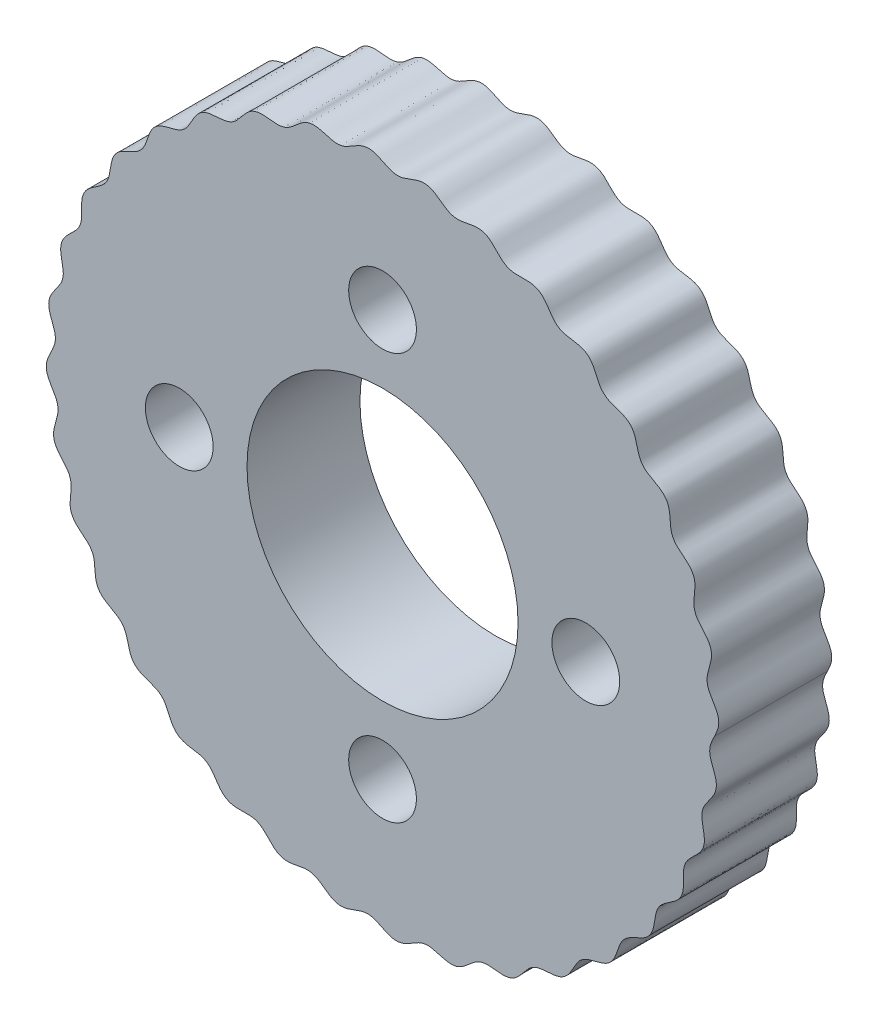
from build123d import *

# Parameters (mm, degrees)
EXTRUDE_1_DEPTH          = 5
EXTRUDE_1_DEPTH_BACK     = 5
SKETCH_1_R               = 12
CUT_EXTRUDE_1_DEPTH      = 10
CUT_EXTRUDE_1_DEPTH_BACK = 10
SKETCH_2_R               = 3


with BuildPart() as part:
    # 草图1 → 凸台-拉伸1 (new, two sides: drawn at the far end of the back side and taken through both)
    with BuildSketch(Plane.XY.offset(-EXTRUDE_1_DEPTH_BACK)):
        with BuildLine():
            add(Edge.make_bspline(
                [(29.4, 1e-09), (29.415799706, 0.032257734), (29.447386284, 0.097157314), (29.504130438, 0.216230806), (29.581276839, 0.388828284), (29.662689077, 0.594615378), (29.736146629, 0.837079135), (29.79281217, 1.177167834), (29.761871702, 1.538482566), (29.661202541, 1.860720262), (29.52960586, 2.143020955), (29.409277433, 2.361282144), (29.281073391, 2.574821404), (29.151314048, 2.787385411), (29.013592374, 3.024352373), (28.8805477, 3.292157346), (28.741661993, 3.681188492), (28.710495892, 4.162346864), (28.820069922, 4.664609592), (28.980612617, 5.187406533), (29.110175028, 5.669040025), (29.161189795, 6.163399707), (29.0681081, 6.650335535), (28.837811598, 7.079047146), (28.541678681, 7.452296187), (28.237076566, 7.788583164), (27.9601478, 8.11960299), (27.740861568, 8.467316311), (27.606987002, 8.833889663), (27.557730755, 9.250478557), (27.583199093, 9.696860688), (27.643664923, 10.169034533), (27.684646208, 10.673210025), (27.639604187, 11.180509219), (27.440858365, 11.651813851), (27.114013611, 12.036813653), (26.734001884, 12.35912965), (26.369533116, 12.641080643), (26.052288593, 12.922691573), (25.80581665, 13.222443157), (25.641395403, 13.53278618), (25.532750281, 13.905442772), (25.481426451, 14.326662638), (25.459161193, 14.786888051), (25.41543983, 15.283233724), (25.294689422, 15.765521226), (25.04045396, 16.191086942), (24.67755534, 16.515280656), (24.271534014, 16.764670299), (23.870340043, 16.976537965), (23.496867346, 17.192857717), (23.17189497, 17.444611691), (22.920711169, 17.743284645), (22.731947862, 18.117906679), (22.603205968, 18.546077397), (22.498533854, 19.010457371), (22.364604651, 19.498243158), (22.148772886, 19.959543512), (21.800816975, 20.334449734), (21.362005845, 20.584443838), (20.894672958, 20.757350056), (20.455751492, 20.897641712), (20.061322511, 21.053765383), (19.727193581, 21.251141376), (19.466544576, 21.486533041), (19.236995499, 21.799556873), (19.044701193, 22.177820288), (18.866372334, 22.602675546), (18.655527473, 23.054134325), (18.377107166, 23.46603726), (17.99265193, 23.778984574), (17.540757995, 23.959508377), (17.073926469, 24.054990512), (16.624464446, 24.116864576), (16.199529196, 24.192403464), (15.808050122, 24.317827717), (15.469862391, 24.512578568), (15.164354624, 24.800047276), (14.896933805, 25.158363819), (14.639746887, 25.558938283), (14.347062038, 25.971500502), (13.986472508, 26.331162229), (13.531275426, 26.564450909), (13.033424826, 26.649286278), (12.535138151, 26.651927715), (12.074704316, 26.633638766), (11.650664873, 26.645444371), (11.269179817, 26.716638311), (10.94374118, 26.848686911), (10.62097515, 27.064322688), (10.310903903, 27.354005502), (9.998020533, 27.692246791), (9.645483177, 28.044366084), (9.242974568, 28.336202879), (8.774670535, 28.498785726), (8.288286362, 28.513865783), (7.816951409, 28.443923855), (7.373433086, 28.348341391), (6.948288745, 28.273988312), (6.537521127, 28.257954828), (6.153119899, 28.325293749), (5.767716415, 28.490936162), (5.393871569, 28.736180267), (5.015190385, 29.024634028), (4.599052003, 29.312211587), (4.137197127, 29.526854175), (3.62966236, 29.590387255), (3.13282042, 29.499831492), (2.663680684, 29.33188955), (2.237269597, 29.157225913), (1.834765106, 29.023289523), (1.451936653, 28.959714368), (1.100961084, 28.972492897), (0.723908452, 29.064731756), (0.333459425, 29.230893958), (-0.076240091, 29.441724363), (-0.527948754, 29.652033425), (-1.005997157, 29.7886042), (-1.501665656, 29.781212777), (-1.963874878, 29.629030058), (-2.382863466, 29.402100401), (-2.766942928, 29.160589478), (-3.141018209, 28.945313536), (-3.521528891, 28.789754566), (-3.905780566, 28.721562201), (-4.324591768, 28.745394304), (-4.759775031, 28.847996678), (-5.214265129, 28.989517152), (-5.703682517, 29.117458396), (-6.211069435, 29.161141245), (-6.709767276, 29.047335675), (-7.145602653, 28.792173717), (-7.529150625, 28.474174684), (-7.869848705, 28.163705506), (-8.202681394, 27.900972769), (-8.616263479, 27.665838441), (-9.084593851, 27.551495613), (-9.598325378, 27.572253944), (-10.141013268, 27.639534156), (-10.637851477, 27.683514959), (-11.133546711, 27.647898492), (-11.596928717, 27.471682063), (-11.979132218, 27.170435226), (-12.295290702, 26.813989846), (-12.573573328, 26.455618062), (-12.851476995, 26.125416346), (-13.155828653, 25.849081358), (-13.493586097, 25.653586072), (-13.895292676, 25.53273811), (-14.339315875, 25.480306162), (-14.814816068, 25.457861206), (-15.318448355, 25.410670762), (-15.810219055, 25.278221438), (-16.239851669, 25.000653829), (-16.562246457, 24.611920061), (-16.813677411, 24.181711985), (-17.028055594, 23.773820037), (-17.25029929, 23.412493948), (-17.502697568, 23.117715151), (-17.779774336, 22.901901333), (-18.127903404, 22.730195634), (-18.533811717, 22.606507471), (-18.983178926, 22.504663158), (-19.464391897, 22.375416515), (-19.918384221, 22.172752207), (-20.293337205, 21.84848048), (-20.549588846, 21.434799393), (-20.724685153, 20.991640517), (-20.863666862, 20.559750897), (-21.011848444, 20.154389001), (-21.203345159, 19.790636366), (-21.453865812, 19.491405768), (-21.790012787, 19.240455566), (-22.189334042, 19.039323135), (-22.628461263, 18.855593505), (-23.08561578, 18.63901075), (-23.502375503, 18.34633173), (-23.811247402, 17.938594812), (-23.981101727, 17.462979832), (-24.070510681, 16.972838556), (-24.131934812, 16.516008863), (-24.218018093, 16.100803181), (-24.383698923, 15.654834396), (-24.668962641, 15.266205747), (-25.075847035, 14.951887292), (-25.534816939, 14.654593872), (-25.943687444, 14.368923678), (-26.300518137, 14.023013124), (-26.54221971, 13.590167301), (-26.64136667, 13.113723152), (-26.654439795, 12.637447411), (-26.637259041, 12.18404204), (-26.637897203, 11.752459874), (-26.693417534, 11.345141425), (-26.826495905, 10.978277201), (-27.056535588, 10.627489992), (-27.362986815, 10.301912787), (-27.712789934, 9.979072144), (-28.068300657, 9.619195521), (-28.359823067, 9.201626425), (-28.510615309, 8.712839302), (-28.507553429, 8.207812815), (-28.423937478, 7.716652868), (-28.325402763, 7.26636175), (-28.264300677, 6.846758976), (-28.267434677, 6.371010596), (-28.402623977, 5.908269874), (-28.67737628, 5.473712906), (-29.007135515, 5.03742327), (-29.293397877, 4.629054484), (-29.518894404, 4.165419321), (-29.595966627, 3.636312712), (-29.507198002, 3.170511123), (-29.374109224, 2.781236696), (-29.248638271, 2.461163887), (-29.162068898, 2.237023074), (-29.094449635, 2.042296759), (-29.039040893, 1.853557352), (-28.996897388, 1.670968158), (-28.968322426, 1.460249393), (-28.967796888, 1.222592746), (-29.000839779, 0.986594945), (-29.062809145, 0.757115235), (-29.14395143, 0.539742477), (-29.245070438, 0.31562102), (-29.334795811, 0.132349301), (-29.378272321, 0.044360679), (-29.4, 0)],
                knots=[0.083173114, 0.083173114, 0.083173114, 0.083173114, 0.083173114, 0.084644122, 0.086115131, 0.08758614, 0.089057148, 0.091999166, 0.094941183, 0.099192142, 0.101317622, 0.103443102, 0.105568581, 0.107694061, 0.109819541, 0.11194502, 0.114919942, 0.117894864, 0.123844707, 0.128095662, 0.132346617, 0.136597572, 0.140848527, 0.144910192, 0.148971857, 0.153033521, 0.157095186, 0.160394667, 0.163694149, 0.166993631, 0.170293113, 0.174608728, 0.178924343, 0.183239958, 0.187555573, 0.191806532, 0.196057492, 0.200308451, 0.20455941, 0.207534332, 0.210509254, 0.213484175, 0.216459097, 0.220710052, 0.224961007, 0.229211962, 0.233462917, 0.237524582, 0.241586246, 0.245647911, 0.249709576, 0.253009057, 0.256308539, 0.259608021, 0.262907502, 0.267223118, 0.271538733, 0.275854348, 0.280169963, 0.284420922, 0.288671881, 0.292922841, 0.2971738, 0.300148722, 0.303123644, 0.306098565, 0.309073487, 0.313324442, 0.317575397, 0.321826352, 0.326077307, 0.330138972, 0.334200636, 0.338262301, 0.342323965, 0.345623447, 0.348922929, 0.352222411, 0.355521892, 0.359837507, 0.364153123, 0.368468738, 0.372784353, 0.377035312, 0.381286271, 0.385537231, 0.38978819, 0.392763112, 0.395738033, 0.398712955, 0.401687877, 0.405938832, 0.410189787, 0.414440742, 0.418691697, 0.422753362, 0.426815026, 0.430876691, 0.434938355, 0.438237837, 0.441537319, 0.4448368, 0.448136282, 0.452451897, 0.456767512, 0.461083128, 0.465398743, 0.469649702, 0.473900661, 0.478151621, 0.48240258, 0.485377502, 0.488352423, 0.491327345, 0.494302267, 0.498553222, 0.502804177, 0.507055132, 0.511306087, 0.515367752, 0.519429416, 0.523491081, 0.527552745, 0.530852227, 0.534151709, 0.53745119, 0.540750672, 0.545066287, 0.549381902, 0.553697517, 0.558013133, 0.562264092, 0.566515051, 0.57076601, 0.57501697, 0.577991891, 0.580966813, 0.586916657, 0.591167612, 0.595418567, 0.599669522, 0.603920477, 0.607982141, 0.612043806, 0.616105471, 0.620167135, 0.623466617, 0.626766099, 0.63006558, 0.633365062, 0.637680677, 0.641996292, 0.646311907, 0.650627522, 0.654878482, 0.659129441, 0.6633804, 0.66763136, 0.670606281, 0.673581203, 0.676556125, 0.679531047, 0.683782002, 0.688032957, 0.692283912, 0.696534867, 0.700596531, 0.704658196, 0.70871986, 0.712781525, 0.716081007, 0.719380488, 0.72267997, 0.725979452, 0.730295067, 0.734610682, 0.738926297, 0.743241912, 0.747492872, 0.751743831, 0.75599479, 0.760245749, 0.763220671, 0.766195593, 0.772145436, 0.776396391, 0.780647347, 0.784898302, 0.789149257, 0.793210921, 0.797272586, 0.80133425, 0.805395915, 0.808695397, 0.811994878, 0.81529436, 0.818593842, 0.822909457, 0.827225072, 0.831540687, 0.835856302, 0.840107262, 0.844358221, 0.84860918, 0.852860139, 0.855835061, 0.858809983, 0.864759826, 0.869010781, 0.873261736, 0.877512691, 0.881763646, 0.886452532, 0.891141418, 0.893485861, 0.895830304, 0.898174747, 0.899346969, 0.90051919, 0.902542115, 0.904565039, 0.906587963, 0.908610887, 0.910633811, 0.912656735, 0.914679659, 0.916702583, 0.916702583, 0.916702583, 0.916702583, 0.916702583], degree=4))
            add(Edge.make_bspline(
                [(-29.4, 0), (-29.415799706, -0.032257733), (-29.447386278, -0.09715727), (-29.504130384, -0.216230363), (-29.581276102, -0.388823012), (-29.66268692, -0.594600179), (-29.736155622, -0.837144622), (-29.792790877, -1.177004051), (-29.756544289, -1.601439785), (-29.595934057, -2.037658571), (-29.348791208, -2.47008319), (-29.102535258, -2.859812362), (-28.901430819, -3.23307262), (-28.741757415, -3.681263995), (-28.710431236, -4.162295396), (-28.820113715, -4.664644538), (-28.980589306, -5.187387916), (-29.110187176, -5.669049729), (-29.161182907, -6.163394205), (-29.0681122, -6.650338811), (-28.837808995, -7.079045067), (-28.541680411, -7.452297569), (-28.237075594, -7.788582387), (-27.960148261, -8.119603358), (-27.740861333, -8.467316124), (-27.606987129, -8.833889764), (-27.557730675, -9.250478494), (-27.583199142, -9.696860727), (-27.643664895, -10.169034511), (-27.684646221, -10.673210036), (-27.639604179, -11.180509213), (-27.44085837, -11.651813854), (-27.114013607, -12.03681365), (-26.734001886, -12.359129652), (-26.369533115, -12.641080642), (-26.052288594, -12.922691574), (-25.80581665, -13.222443157), (-25.641395403, -13.53278618), (-25.532750281, -13.905442771), (-25.481426451, -14.326662638), (-25.459161193, -14.786888051), (-25.41543983, -15.283233724), (-25.294689422, -15.765521226), (-25.04045396, -16.191086942), (-24.67755534, -16.515280656), (-24.271534014, -16.764670299), (-23.870340043, -16.976537965), (-23.496867346, -17.192857717), (-23.17189497, -17.444611691), (-22.920711169, -17.743284645), (-22.731947862, -18.117906679), (-22.603205968, -18.546077397), (-22.498533854, -19.010457371), (-22.364604651, -19.498243158), (-22.148772886, -19.959543512), (-21.800816975, -20.334449734), (-21.362005845, -20.584443838), (-20.894672958, -20.757350056), (-20.455751492, -20.897641712), (-20.061322511, -21.053765383), (-19.727193581, -21.251141376), (-19.466544576, -21.486533041), (-19.236995499, -21.799556873), (-19.044701193, -22.177820288), (-18.866372334, -22.602675546), (-18.655527473, -23.054134325), (-18.377107166, -23.46603726), (-17.99265193, -23.778984574), (-17.540757995, -23.959508377), (-17.073926469, -24.054990512), (-16.624464446, -24.116864576), (-16.199529196, -24.192403464), (-15.808050122, -24.317827717), (-15.469862391, -24.512578568), (-15.164354624, -24.800047276), (-14.896933805, -25.158363819), (-14.639746887, -25.558938283), (-14.347062038, -25.971500502), (-13.986472508, -26.331162229), (-13.531275426, -26.564450909), (-13.033424826, -26.649286278), (-12.535138151, -26.651927715), (-12.074704316, -26.633638766), (-11.650664873, -26.645444371), (-11.269179817, -26.716638311), (-10.94374118, -26.848686911), (-10.62097515, -27.064322688), (-10.310903903, -27.354005502), (-9.998020533, -27.692246791), (-9.645483177, -28.044366084), (-9.242974568, -28.336202879), (-8.774670535, -28.498785726), (-8.288286362, -28.513865783), (-7.816951408, -28.443923855), (-7.373433086, -28.348341391), (-6.948288745, -28.273988312), (-6.537521127, -28.257954828), (-6.153119899, -28.325293749), (-5.767716415, -28.490936162), (-5.393871569, -28.736180267), (-5.015190385, -29.024634028), (-4.599052003, -29.312211587), (-4.137197127, -29.526854175), (-3.62966236, -29.590387255), (-3.13282042, -29.499831492), (-2.663680684, -29.33188955), (-2.237269596, -29.157225914), (-1.834765106, -29.023289523), (-1.451936652, -28.959714369), (-1.100961085, -28.972492895), (-0.72390845, -29.064731759), (-0.333459429, -29.230893949), (0.076240099, -29.441724378), (0.527948742, -29.652033402), (1.005997174, -29.788604233), (1.501665627, -29.781212722), (1.963874929, -29.629030156), (2.382863358, -29.402100194), (2.766943125, -29.160589857), (3.141017874, -28.94531289), (3.521529399, -28.789755543), (3.905779664, -28.721560467), (4.324593516, -28.745397666), (4.759771183, -28.847989274), (5.214272094, -28.989530551), (5.703671578, -29.117437352), (6.211085286, -29.161171738), (6.709741554, -29.04728619), (7.145648364, -28.792261656), (7.529055985, -28.473992613), (7.870012856, -28.164021302), (8.202434411, -27.90049762), (8.540431501, -27.709821474), (8.874611165, -27.601788647), (9.260472294, -27.559505231), (9.684205173, -27.582105185), (10.14130505, -27.640095492), (10.637702251, -27.683227875), (11.133630811, -27.648060284), (11.596878752, -27.47158594), (11.979163919, -27.170496214), (12.295269636, -26.813949321), (12.573585159, -26.455640823), (12.851471381, -26.125405545), (13.155831507, -25.849086849), (13.493584557, -25.653583108), (13.895293644, -25.532739974), (14.339315283, -25.480305023), (14.814816403, -25.45786185), (15.31844819, -25.410670445), (15.810219148, -25.278221616), (16.239851612, -25.000653719), (16.562246497, -24.611920137), (16.813677385, -24.181711936), (17.028055608, -23.773820064), (17.250299284, -23.412493937), (17.502697572, -23.117715157), (17.779774333, -22.90190133), (18.127903408, -22.730195637), (18.533811708, -22.606507467), (18.983178942, -22.504663165), (19.464391873, -22.375416505), (19.918384256, -22.172752222), (20.293337148, -21.848480456), (20.549588947, -21.434799435), (20.724684938, -20.991640427), (20.863667257, -20.559751061), (21.011847772, -20.154388722), (21.203346176, -19.790636788), (21.453864007, -19.491405019), (21.790016287, -19.240457018), (22.189326335, -19.039319937), (22.628475211, -18.855599292), (23.085593874, -18.639001661), (23.502407246, -18.3463449), (23.81119589, -17.938573439), (23.981193269, -17.463017815), (24.070321149, -16.972759915), (24.132263547, -16.516145262), (24.217523475, -16.100597953), (24.353880004, -15.73727121), (24.540434315, -15.439706716), (24.808841833, -15.159288987), (25.147967021, -14.904231311), (25.535401292, -14.654836327), (25.943388571, -14.368799679), (26.300686597, -14.023083008), (26.542119586, -13.59012578), (26.64143027, -13.1137495), (26.65439737, -12.637429895), (26.637283171, -12.184051893), (26.637885216, -11.752455171), (26.693424375, -11.345143854), (26.826490823, -10.978275819), (27.056541399, -10.627490995), (27.362977105, -10.30191186), (27.712806031, -9.979073211), (28.068276099, -9.619194146), (28.359858361, -9.201628296), (28.510558223, -8.712836343), (28.507654754, -8.207818021), (28.423727805, -7.716642135), (28.325766369, -7.26638034), (28.263753639, -6.846731018), (28.267630633, -6.458682159), (28.341144705, -6.11525151), (28.497490902, -5.759956931), (28.728853225, -5.404265206), (29.007774885, -5.037455943), (29.293078173, -4.629038147), (29.519083958, -4.165429008), (29.595836799, -3.636306078), (29.507277386, -3.17051518), (29.374070056, -2.781234695), (29.248652055, -2.461164592), (29.162067673, -2.237023011), (29.094448891, -2.042296721), (29.03904069, -1.853557341), (28.996897598, -1.670968169), (28.96832239, -1.460249391), (28.967796876, -1.222592745), (29.000839784, -0.986594945), (29.062809145, -0.757115235), (29.143951429, -0.539742477), (29.245070438, -0.31562102), (29.334795812, -0.132349301), (29.378272321, -0.044360678), (29.4, 1e-09)],
                knots=[0.083173114, 0.083173114, 0.083173114, 0.083173114, 0.083173114, 0.084644122, 0.086115131, 0.08758614, 0.089057148, 0.091999166, 0.094941183, 0.099192142, 0.103443102, 0.107694061, 0.11194502, 0.114919942, 0.117894864, 0.123844707, 0.128095662, 0.132346617, 0.136597572, 0.140848527, 0.144910192, 0.148971857, 0.153033521, 0.157095186, 0.160394667, 0.163694149, 0.166993631, 0.170293113, 0.174608728, 0.178924343, 0.183239958, 0.187555573, 0.191806532, 0.196057492, 0.200308451, 0.20455941, 0.207534332, 0.210509254, 0.213484175, 0.216459097, 0.220710052, 0.224961007, 0.229211962, 0.233462917, 0.237524582, 0.241586246, 0.245647911, 0.249709576, 0.253009057, 0.256308539, 0.259608021, 0.262907502, 0.267223118, 0.271538733, 0.275854348, 0.280169963, 0.284420922, 0.288671881, 0.292922841, 0.2971738, 0.300148722, 0.303123644, 0.306098565, 0.309073487, 0.313324442, 0.317575397, 0.321826352, 0.326077307, 0.330138972, 0.334200636, 0.338262301, 0.342323965, 0.345623447, 0.348922929, 0.352222411, 0.355521892, 0.359837507, 0.364153123, 0.368468738, 0.372784353, 0.377035312, 0.381286271, 0.385537231, 0.38978819, 0.392763112, 0.395738033, 0.398712955, 0.401687877, 0.405938832, 0.410189787, 0.414440742, 0.418691697, 0.422753362, 0.426815026, 0.430876691, 0.434938355, 0.438237837, 0.441537319, 0.4448368, 0.448136282, 0.452451897, 0.456767512, 0.461083128, 0.465398743, 0.469649702, 0.473900661, 0.478151621, 0.48240258, 0.485377502, 0.488352423, 0.491327345, 0.494302267, 0.498553222, 0.502804177, 0.507055132, 0.511306087, 0.515367752, 0.519429416, 0.523491081, 0.527552745, 0.530852227, 0.534151709, 0.53745119, 0.540750672, 0.545066287, 0.549381902, 0.553697517, 0.558013133, 0.562264092, 0.566515051, 0.57076601, 0.57501697, 0.577991891, 0.580966813, 0.583941735, 0.586916657, 0.591167612, 0.595418567, 0.599669522, 0.603920477, 0.607982141, 0.612043806, 0.616105471, 0.620167135, 0.623466617, 0.626766099, 0.63006558, 0.633365062, 0.637680677, 0.641996292, 0.646311907, 0.650627522, 0.654878482, 0.659129441, 0.6633804, 0.66763136, 0.670606281, 0.673581203, 0.676556125, 0.679531047, 0.683782002, 0.688032957, 0.692283912, 0.696534867, 0.700596531, 0.704658196, 0.70871986, 0.712781525, 0.716081007, 0.719380488, 0.72267997, 0.725979452, 0.730295067, 0.734610682, 0.738926297, 0.743241912, 0.747492872, 0.751743831, 0.75599479, 0.760245749, 0.763220671, 0.766195593, 0.769170515, 0.772145436, 0.776396391, 0.780647347, 0.784898302, 0.789149257, 0.793210921, 0.797272586, 0.80133425, 0.805395915, 0.808695397, 0.811994878, 0.81529436, 0.818593842, 0.822909457, 0.827225072, 0.831540687, 0.835856302, 0.840107262, 0.844358221, 0.84860918, 0.852860139, 0.855835061, 0.858809983, 0.861784905, 0.864759826, 0.869010781, 0.873261736, 0.877512691, 0.881763646, 0.886452532, 0.891141418, 0.893485861, 0.895830304, 0.898174747, 0.899346969, 0.90051919, 0.902542115, 0.904565039, 0.906587963, 0.908610887, 0.910633811, 0.912656735, 0.914679659, 0.916702583, 0.916702583, 0.916702583, 0.916702583, 0.916702583], degree=4))
        make_face()
        Circle(SKETCH_1_R, mode=Mode.SUBTRACT)
    extrude(amount=EXTRUDE_1_DEPTH + EXTRUDE_1_DEPTH_BACK)

    # 草图2 → 切除-拉伸1 (cut, two sides: drawn at the far end of the back side and taken through both)
    with BuildSketch(Plane.XY.offset(-CUT_EXTRUDE_1_DEPTH_BACK)):
        with Locations((18, 0)):
            Circle(SKETCH_2_R)
        with Locations((0, -18)):
            Circle(SKETCH_2_R)
        with Locations((-18, 0)):
            Circle(SKETCH_2_R)
        with Locations((0, 18)):
            Circle(SKETCH_2_R)
    extrude(amount=CUT_EXTRUDE_1_DEPTH + CUT_EXTRUDE_1_DEPTH_BACK, mode=Mode.SUBTRACT)


solid = part.part
